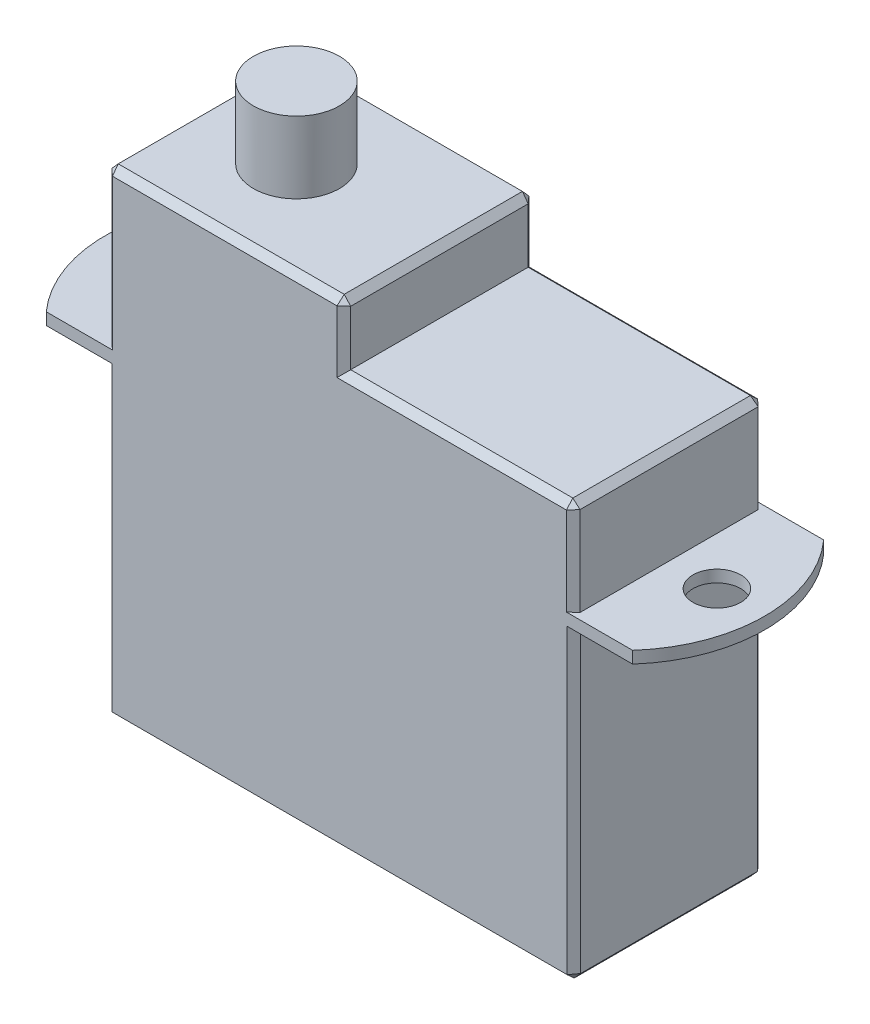
from build123d import *
from OCP.BRepFilletAPI import BRepFilletAPI_MakeChamfer

# Parameters (mm, degrees)
SKETCH_1_W          = 19.6
SKETCH_1_H          = 8
EXTRUDE_1_DEPTH     = 12.9
SKETCH_2_W          = 27.6
SKETCH_2_H          = 8
SKETCH_2_R          = 1
EXTRUDE_2_DEPTH     = 0.5
SKETCH_3_W          = 19.6
SKETCH_3_H          = 8
EXTRUDE_3_DEPTH     = 17.4
SKETCH_4_W          = 10
SKETCH_4_H          = 8
EXTRUDE_5_DEPTH     = 20
SKETCH_6_R          = 1.8
EXTRUDE_6_DEPTH     = 3
CUT_EXTRUDE_2_DEPTH = 17
CHAMFER_1_SIZE      = 0.3
CHAMFER_1_SIZE2     = 0.270121213


with BuildPart() as part:
    # 草图1 → 凸台-拉伸1 (new body)
    with BuildSketch(Plane(origin=(0, 0, 0), x_dir=(1, 0, 0), z_dir=(0, 1, 0))):
        Rectangle(SKETCH_1_W, SKETCH_1_H)
    extrude(amount=EXTRUDE_1_DEPTH)

    # 草图2 → 凸台-拉伸2 (add)
    with BuildSketch(Plane(origin=(0, 12.9, 0), x_dir=(1, 0, 0), z_dir=(0, 1, 0))):
        Rectangle(SKETCH_2_W, SKETCH_2_H)
        with Locations(Location((-11.8, 0, 0), (0, 0, 270))):
            Circle(SKETCH_2_R, mode=Mode.SUBTRACT)
        with Locations(Location((11.8, 0, 0), (0, 0, 270))):
            Circle(SKETCH_2_R, mode=Mode.SUBTRACT)
    extrude(amount=EXTRUDE_2_DEPTH)

    # 草图3 → 凸台-拉伸3 (add)
    with BuildSketch(Plane.XZ):
        Rectangle(SKETCH_3_W, SKETCH_3_H)
    extrude(amount=-EXTRUDE_3_DEPTH)

    # 草图4 → 凸台-拉伸5 (add)
    with BuildSketch(Plane(origin=(0, 0, 0), x_dir=(1, 0, 0), z_dir=(0, 1, 0))):
        with Locations((-4.8, 0)):
            Rectangle(SKETCH_4_W, SKETCH_4_H)
    extrude(amount=EXTRUDE_5_DEPTH)

    # 草图6 → 凸台-拉伸6 (add)
    with BuildSketch(Plane(origin=(0, 20, 0), x_dir=(1, 0, 0), z_dir=(0, 1, 0))):
        with Locations(Location((-5.8, 0, 0), (0, 0, 90))):
            Circle(SKETCH_6_R)
    extrude(amount=EXTRUDE_6_DEPTH)

    # 草图7 → 切除-拉伸2 (cut)
    with BuildSketch(Plane.XZ):
        with BuildLine():
            Line((14.367004184, -5.785535706), (9.389835398, -5.785535706))
            ThreePointArc((9.389835398, -5.785535706), (13.783545245, -0.444056645), (10.226439047, 5.487476064))
            Line((10.226439047, 5.487476064), (14.54010062, 5.487476064))
            Line((14.54010062, 5.487476064), (14.367004184, -5.785535706))
        make_face()
        with BuildLine():
            Line((-10.226439047, 5.487476064), (-14.54010062, 5.487476064))
            Line((-14.54010062, 5.487476064), (-14.367004184, -5.785535706))
            Line((-14.367004184, -5.785535706), (-9.389835398, -5.785535706))
            ThreePointArc((-9.389835398, -5.785535706), (-13.783545245, -0.444056645), (-10.226439047, 5.487476064))
        make_face()
    extrude(amount=-CUT_EXTRUDE_2_DEPTH, mode=Mode.SUBTRACT)

    # 倒角1: one chamfer whose edges measure the first distance from different faces: ONE call of the kernel's chamfer builder (chamfer() names one face for all edges)
    chamfer_1_edges_1 = [part.edges().sort_by_distance(p)[0] for p in [
        (9.8, 15.4, -4),
        (-9.8, 16.7, -4),
        (-4.8, 20, -4),
    ]]
    chamfer_1_side_1 = [part.faces().sort_by_distance(p)[0] for p in [
        (-0.337742628, 9.433402177, -4),
    ]]
    chamfer_1_edges_2 = [part.edges().sort_by_distance(p)[0] for p in [
        (-9.8, 16.7, 4),
        (5, 17.4, 4),
        (9.8, 15.4, 4),
        (0.2, 18.7, 4),
        (-4.8, 20, 4),
    ]]
    chamfer_1_side_2 = [part.faces().sort_by_distance(p)[0] for p in [
        (-0.337742628, 9.433402177, 4),
    ]]
    chamfer_1_edges_3 = [part.edges().sort_by_distance(p)[0] for p in [
        (9.8, 17.4, 0),
        (5, 17.4, -4),
    ]]
    chamfer_1_side_3 = [part.faces().sort_by_distance(p)[0] for p in [
        (5, 17.4, 0),
    ]]
    chamfer_1_edges_4 = [part.edges().sort_by_distance(p)[0] for p in [
        (0, 0, 4),
        (-9.8, 0, 0),
        (0, 0, -4),
    ]]
    chamfer_1_side_4 = [part.faces().sort_by_distance(p)[0] for p in [
        (0, 0, 0),
    ]]
    chamfer_1_edges_5 = [part.edges().sort_by_distance(p)[0] for p in [
        (0.2, 18.7, -4),
        (0.2, 20, 0),
    ]]
    chamfer_1_side_5 = [part.faces().sort_by_distance(p)[0] for p in [
        (0.2, 18.7, 0),
    ]]
    chamfer_1_edges_6 = [part.edges().sort_by_distance(p)[0] for p in [
        (9.8, 0, 0),
        (9.8, 6.45, 4),
        (9.8, 6.45, -4),
    ]]
    chamfer_1_side_6 = [part.faces().sort_by_distance(p)[0] for p in [
        (9.8, 6.45, 0),
    ]]
    chamfer_1_edges_7 = [part.edges().sort_by_distance(p)[0] for p in [
        (-9.8, 20, 0),
    ]]
    chamfer_1_side_7 = [part.faces().sort_by_distance(p)[0] for p in [
        (-9.8, 16.7, 0),
    ]]
    chamfer_1_edges_8 = [part.edges().sort_by_distance(p)[0] for p in [
        (-9.8, 6.45, 4),
        (-9.8, 6.45, -4),
    ]]
    chamfer_1_side_8 = [part.faces().sort_by_distance(p)[0] for p in [
        (-9.8, 6.45, 0),
    ]]
    chamfer_1 = BRepFilletAPI_MakeChamfer(part.part.solid().wrapped)
    for e in chamfer_1_edges_1:
        chamfer_1.Add(CHAMFER_1_SIZE, CHAMFER_1_SIZE2, e.wrapped, chamfer_1_side_1[0].wrapped)  # the first distance lies on this face
    for e in chamfer_1_edges_2:
        chamfer_1.Add(CHAMFER_1_SIZE, CHAMFER_1_SIZE2, e.wrapped, chamfer_1_side_2[0].wrapped)  # the first distance lies on this face
    for e in chamfer_1_edges_3:
        chamfer_1.Add(CHAMFER_1_SIZE, CHAMFER_1_SIZE2, e.wrapped, chamfer_1_side_3[0].wrapped)  # the first distance lies on this face
    for e in chamfer_1_edges_4:
        chamfer_1.Add(CHAMFER_1_SIZE, CHAMFER_1_SIZE2, e.wrapped, chamfer_1_side_4[0].wrapped)  # the first distance lies on this face
    for e in chamfer_1_edges_5:
        chamfer_1.Add(CHAMFER_1_SIZE, CHAMFER_1_SIZE2, e.wrapped, chamfer_1_side_5[0].wrapped)  # the first distance lies on this face
    for e in chamfer_1_edges_6:
        chamfer_1.Add(CHAMFER_1_SIZE, CHAMFER_1_SIZE2, e.wrapped, chamfer_1_side_6[0].wrapped)  # the first distance lies on this face
    for e in chamfer_1_edges_7:
        chamfer_1.Add(CHAMFER_1_SIZE, CHAMFER_1_SIZE2, e.wrapped, chamfer_1_side_7[0].wrapped)  # the first distance lies on this face
    for e in chamfer_1_edges_8:
        chamfer_1.Add(CHAMFER_1_SIZE, CHAMFER_1_SIZE2, e.wrapped, chamfer_1_side_8[0].wrapped)  # the first distance lies on this face
    add(Compound.cast(chamfer_1.Shape()), mode=Mode.REPLACE)


solid = part.part
